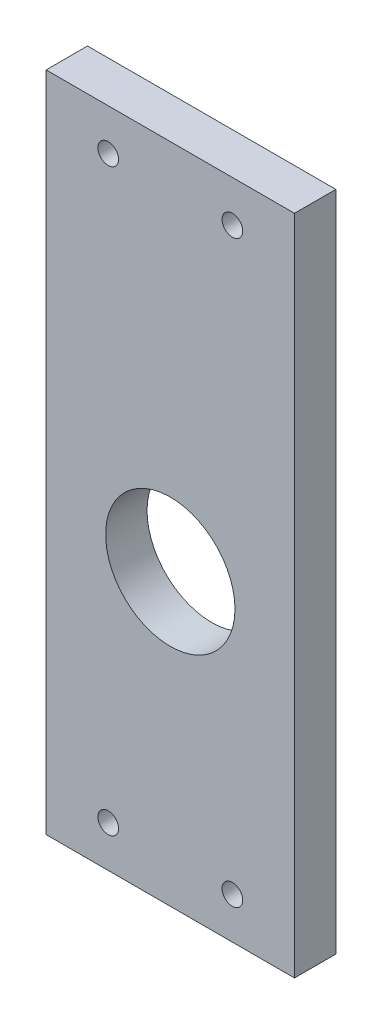
from build123d import *

# Parameters (mm, degrees)
SKETCH1_W           = 76.2
SKETCH1_H           = 203.2
BOSS_EXTRUDE1_DEPTH = 12.7
SKETCH2_R           = 19.84375
CUT_EXTRUDE1_DEPTH  = 12.7
SKETCH3_R           = 3.175
CUT_EXTRUDE2_DEPTH  = 12.7


with BuildPart() as part:
    # Sketch1 → Boss-Extrude1 (new body)
    with BuildSketch(Plane.XY):
        with Locations((38.1, 101.6)):
            Rectangle(SKETCH1_W, SKETCH1_H)
    extrude(amount=BOSS_EXTRUDE1_DEPTH)

    # Sketch2 → Cut-Extrude1 (cut)
    with BuildSketch(Plane.XY.offset(12.7)):
        with Locations((38.1, 88.9)):
            Circle(SKETCH2_R)
    extrude(amount=-CUT_EXTRUDE1_DEPTH, mode=Mode.SUBTRACT)

    # Sketch3 → Cut-Extrude2 (cut)
    with BuildSketch(Plane.XY.offset(12.7)):
        with Locations((19.05, 190.5)):
            Circle(SKETCH3_R)
        with Locations((57.15, 190.5)):
            Circle(SKETCH3_R)
        with Locations((19.05, 12.7)):
            Circle(SKETCH3_R)
        with Locations((57.15, 12.7)):
            Circle(SKETCH3_R)
    extrude(amount=-CUT_EXTRUDE2_DEPTH, mode=Mode.SUBTRACT)


solid = part.part
